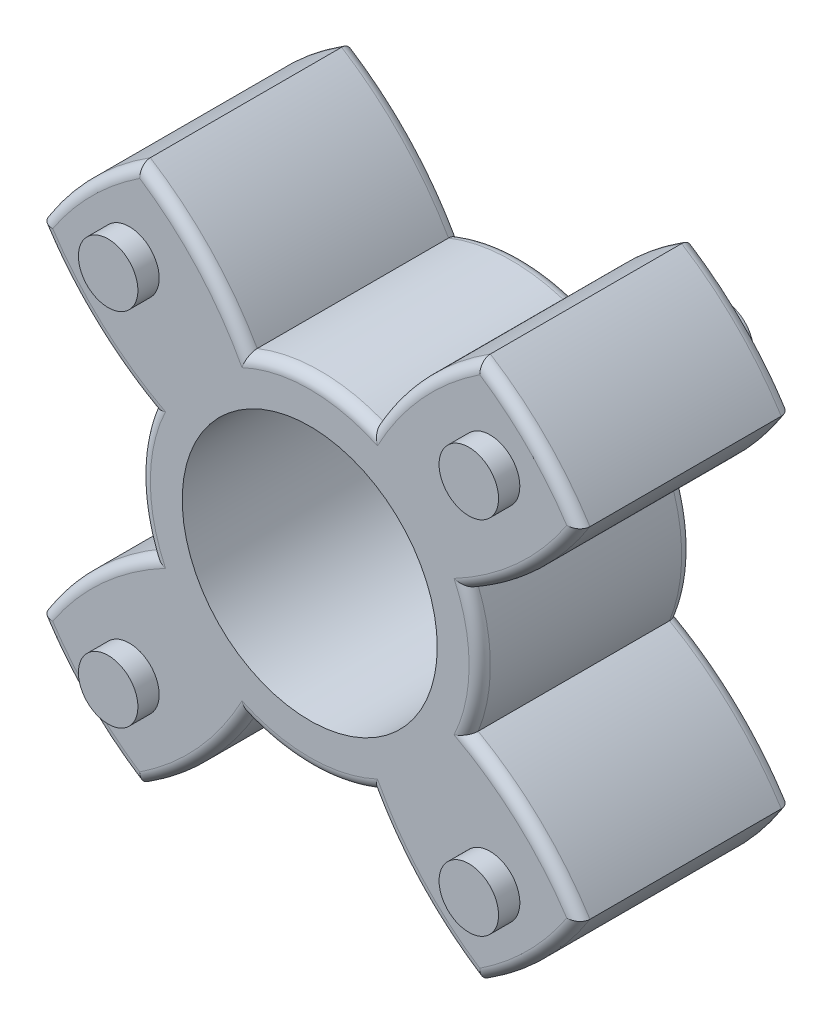
from build123d import *

# Parameters (mm, degrees)
SKETCH1_R           = 6
BOSS_EXTRUDE1_DEPTH = 10
SKETCH2_R           = 1.4
BOSS_EXTRUDE2_DEPTH = 1
CIRPATTERN1_COUNT   = 4
BOSS_EXTRUDE3_START = 1
SKETCH3_R           = 1.4
BOSS_EXTRUDE3_DEPTH = 1
CIRPATTERN2_COUNT   = 2
FILLET1_R           = 0.5
FILLET2_R           = 0.5


with BuildPart() as part:
    # Sketch1 → Boss-Extrude1 (new body)
    with BuildSketch(Plane.XY):
        with BuildLine():
            ThreePointArc((8, 12.68857754), (5.160499055, 10.368472369), (2.96875, 7.428763251))
            ThreePointArc((2.96875, 7.428763251), (0, 8), (-2.96875, 7.428763251))
            ThreePointArc((-2.96875, 7.428763251), (-5.160499055, 10.368472369), (-8, 12.68857754))
            ThreePointArc((-8, 12.68857754), (-10.606601718, 10.606601718), (-12.68857754, 8))
            ThreePointArc((-12.68857754, 8), (-10.368472369, 5.160499055), (-7.428763251, 2.96875))
            ThreePointArc((-7.428763251, 2.96875), (-8, 0), (-7.428763251, -2.96875))
            ThreePointArc((-7.428763251, -2.96875), (-10.368472369, -5.160499055), (-12.68857754, -8))
            ThreePointArc((-12.68857754, -8), (-10.606601718, -10.606601718), (-8, -12.68857754))
            ThreePointArc((-8, -12.68857754), (-5.160499055, -10.368472369), (-2.96875, -7.428763251))
            ThreePointArc((-2.96875, -7.428763251), (0, -8), (2.96875, -7.428763251))
            ThreePointArc((2.96875, -7.428763251), (5.160499055, -10.368472369), (8, -12.68857754))
            ThreePointArc((8, -12.68857754), (10.606601718, -10.606601718), (12.68857754, -8))
            ThreePointArc((12.68857754, -8), (10.368472369, -5.160499055), (7.428763251, -2.96875))
            ThreePointArc((7.428763251, -2.96875), (8, 0), (7.428763251, 2.96875))
            ThreePointArc((7.428763251, 2.96875), (10.368472369, 5.160499055), (12.68857754, 8))
            ThreePointArc((12.68857754, 8), (10.606601718, 10.606601718), (8, 12.68857754))
        make_face()
        Circle(SKETCH1_R, mode=Mode.SUBTRACT)
    extrude(amount=BOSS_EXTRUDE1_DEPTH)

    # Sketch2 → Boss-Extrude2 (add)
    with BuildSketch(Plane.XY.offset(10)):
        with Locations((-8.485281374, 8.485281374)):
            Circle(SKETCH2_R)
    boss_extrude2 = extrude(amount=BOSS_EXTRUDE2_DEPTH)

    # CirPattern1: Boss-Extrude2 ×4 about axis
    cirpattern1_axis = Axis((0, 0, 0), (0, 0, 1))
    for i in range(1, CIRPATTERN1_COUNT):
        add(boss_extrude2.rotate(cirpattern1_axis, i * 360 / CIRPATTERN1_COUNT))

    # Sketch3 → Boss-Extrude3 (add)
    with BuildSketch(Plane(origin=(0, 0, 0), x_dir=(-1, 0, 0), z_dir=(0, 0, -1)).offset(BOSS_EXTRUDE3_START)):
        with Locations((-8.485281374, 8.485281374)):
            Circle(SKETCH3_R)
    boss_extrude3 = extrude(amount=-BOSS_EXTRUDE3_DEPTH)

    # CirPattern2: Boss-Extrude3 ×2 about axis
    cirpattern2_axis = Axis((0, 0, 0), (0, 0, 1))
    for i in range(1, CIRPATTERN2_COUNT):
        add(boss_extrude3.rotate(cirpattern2_axis, i * 360 / CIRPATTERN2_COUNT))

    # Fillet1
    fillet1_edges = [part.edges().sort_by_distance(p)[0] for p in [
        (5.160499055, -10.368472369, 0),
        (0, -8, 0),
        (-5.160499055, -10.368472369, 0),
        (-10.606601718, -10.606601718, 0),
        (-10.368472369, -5.160499055, 0),
        (-8, 0, 0),
        (-10.368472369, 5.160499055, 0),
        (-10.606601718, 10.606601718, 0),
        (-5.160499055, 10.368472369, 0),
        (5.160499055, 10.368472369, 0),
        (10.606601718, 10.606601718, 0),
        (0, 8, 0),
        (10.368472369, 5.160499055, 0),
        (8, 0, 0),
        (10.368472369, -5.160499055, 0),
        (10.606601718, -10.606601718, 0),
    ]]
    fillet(fillet1_edges, radius=FILLET1_R)

    # Fillet2
    fillet2_edges = [part.edges().sort_by_distance(p)[0] for p in [
        (-10.368472369, 5.160499055, 10),
        (-8, 0, 10),
        (-10.368472369, -5.160499055, 10),
        (-10.606601718, -10.606601718, 10),
        (-5.160499055, -10.368472369, 10),
        (0, -8, 10),
        (5.160499055, -10.368472369, 10),
        (10.606601718, -10.606601718, 10),
        (10.368472369, -5.160499055, 10),
        (8, 0, 10),
        (10.368472369, 5.160499055, 10),
        (5.160499055, 10.368472369, 10),
        (10.606601718, 10.606601718, 10),
        (-5.160499055, 10.368472369, 10),
        (0, 8, 10),
        (-10.606601718, 10.606601718, 10),
    ]]
    fillet(fillet2_edges, radius=FILLET2_R)


solid = part.part
